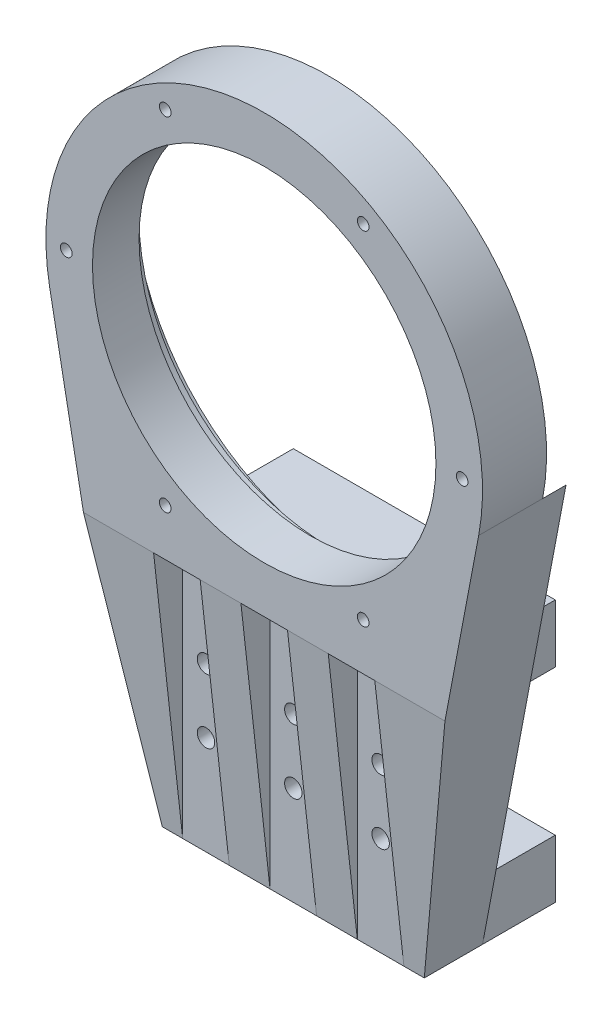
from build123d import *

# Parameters (mm, degrees)
SKETCH1_R               = 37.5
SKETCH1_R_2             = 29.5
BOSS_EXTRUDE1_DEPTH     = 15
SKETCH2_R               = 32.5
SKETCH2_R_2             = 27.5
CUT_EXTRUDE1_DEPTH      = 7
SKETCH9_R               = 1
CUT_EXTRUDE5_DEPTH      = 15
SKETCH10_R              = 37.5
CUT_EXTRUDE6_DEPTH      = 4
SKETCH7_W               = 45
SKETCH7_H               = 10
BOSS_EXTRUDE3_DEPTH     = 12.5
SKETCH12_R              = 1.5
CUT_EXTRUDE8_DEPTH      = 15
CUT_EXTRUDE9_DEPTH      = 35
CUT_EXTRUDE9_DEPTH_BACK = 35
SKETCH14_W              = 8
SKETCH14_H              = 44.996878368
CUT_EXTRUDE10_DEPTH     = 5


with BuildPart() as part:
    # Sketch1 → Boss-Extrude1 (new body)
    # profile 1 of 2: a face of its own
    with BuildSketch(Plane.XY):
        Circle(SKETCH1_R)
        Circle(SKETCH1_R_2, mode=Mode.SUBTRACT)
    # profile 2 of 2: a face of its own
    with BuildSketch(Plane.XY):
        with BuildLine():
            Line((-22.5, -82.5), (22.5, -82.5))
            Line((22.5, -82.5), (36.841286084, -6.997831068))
            ThreePointArc((36.841286084, -6.997831068), (0, -37.5), (-36.841286084, -6.997831068))
            Line((-36.841286084, -6.997831068), (-22.5, -82.5))
        make_face()
    extrude(amount=BOSS_EXTRUDE1_DEPTH)

    # Sketch2 → Cut-Extrude1 (cut)
    with BuildSketch(Plane(origin=(0, 0, 0), x_dir=(-1, 0, 0), z_dir=(0, 0, -1))):
        Circle(SKETCH2_R)
        Circle(SKETCH2_R_2, mode=Mode.SUBTRACT)
    extrude(amount=-CUT_EXTRUDE1_DEPTH, mode=Mode.SUBTRACT)

    # Sketch9 → Cut-Extrude5 (cut)
    with BuildSketch(Plane.XY.offset(15)):
        with Locations((17, 29.444863729)):
            Circle(SKETCH9_R)
        with Locations((34, 0)):
            Circle(SKETCH9_R)
        with Locations((17, -29.444863729)):
            Circle(SKETCH9_R)
        with Locations((-17, -29.444863729)):
            Circle(SKETCH9_R)
        with Locations((-34, 0)):
            Circle(SKETCH9_R)
        with Locations((-17, 29.444863729)):
            Circle(SKETCH9_R)
    extrude(amount=-CUT_EXTRUDE5_DEPTH, mode=Mode.SUBTRACT)

    # Sketch10 → Cut-Extrude6 (cut)
    with BuildSketch(Plane(origin=(0, 0, 0), x_dir=(-1, 0, 0), z_dir=(0, 0, -1))):
        Circle(SKETCH10_R)
    extrude(amount=-CUT_EXTRUDE6_DEPTH, mode=Mode.SUBTRACT)

    # Sketch7 → Boss-Extrude3 (add)
    with BuildSketch(Plane(origin=(0, 0, 0), x_dir=(-1, 0, 0), z_dir=(0, 0, -1))):
        with Locations((0, -77.5)):
            Rectangle(SKETCH7_W, SKETCH7_H)
        with Locations((0, -42.5)):
            Rectangle(SKETCH7_W, SKETCH7_H)
    extrude(amount=BOSS_EXTRUDE3_DEPTH)

    # Sketch12 → Cut-Extrude8 (cut)
    with BuildSketch(Plane(origin=(0, 0, 0), x_dir=(-1, 0, 0), z_dir=(0, 0, -1))):
        with Locations((-15, -54.5)):
            Circle(SKETCH12_R)
        with Locations((0, -54.5)):
            Circle(SKETCH12_R)
        with Locations((15, -54.5)):
            Circle(SKETCH12_R)
        with Locations((-15, -65.5)):
            Circle(SKETCH12_R)
        with Locations((0, -65.5)):
            Circle(SKETCH12_R)
        with Locations((15, -65.5)):
            Circle(SKETCH12_R)
    extrude(amount=-CUT_EXTRUDE8_DEPTH, mode=Mode.SUBTRACT)

    # Sketch13 → Cut-Extrude9 (cut, two sides: drawn at the far end of the back side and taken through both)
    with BuildSketch(Plane(origin=(0, 0, 0), x_dir=(0, 0, -1), z_dir=(1, 0, 0)).offset(-CUT_EXTRUDE9_DEPTH_BACK)):
        Polygon((-15, -82.5), (-15, -37.5), (-10, -82.5), align=None)
    extrude(amount=CUT_EXTRUDE9_DEPTH + CUT_EXTRUDE9_DEPTH_BACK, mode=Mode.SUBTRACT)

    # Sketch14 → Cut-Extrude10 (cut)
    with BuildSketch(Plane.XY.offset(15)):
        with Locations((-15, -59.998439184)):
            Rectangle(SKETCH14_W, SKETCH14_H)
        with Locations((15, -59.998439184)):
            Rectangle(SKETCH14_W, SKETCH14_H)
        with Locations((0, -59.998439184)):
            Rectangle(SKETCH14_W, SKETCH14_H)
    extrude(amount=-CUT_EXTRUDE10_DEPTH, mode=Mode.SUBTRACT)


solid = part.part
